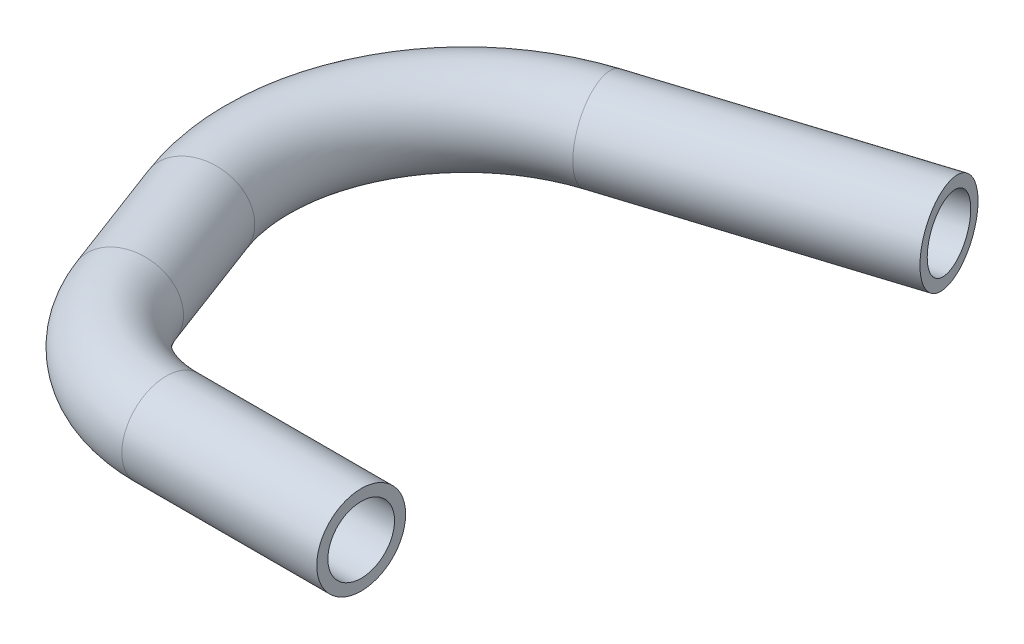
from build123d import *

# Parameters (mm, degrees)
SKETCH2_R   = 16
SKETCH2_R_2 = 12


with BuildPart() as part:
    # Sweep1: sweep along a path in Sketch1
    with BuildLine(Plane(origin=(0, 0, 0), x_dir=(1, 0, 0), z_dir=(0, 1, 0))) as sweep1_path:
        Line((0, 0), (-70.1970105, 0))
        ThreePointArc((-70.1970105, 0), (-98.652281007, 8.886771224), (-116.99253235, 32.388096786))
        Line((-116.99253235, 32.388096786), (-132.496272122, 73.582145179))
        ThreePointArc((-132.496272122, 73.582145179), (-129.748156844, 132.804715841), (-84.855924311, 171.528771306))
        Line((-84.855924311, 171.528771306), (10.197010652, 201.498846579))
    # Sketch2 → Sweep1 (sweep)
    with BuildSketch(Plane(origin=(0, 0, 0), x_dir=(0, 0, -1), z_dir=(1, 0, 0))):
        Circle(SKETCH2_R)
        Circle(SKETCH2_R_2, mode=Mode.SUBTRACT)
    sweep(path=sweep1_path.line)


solid = part.part
